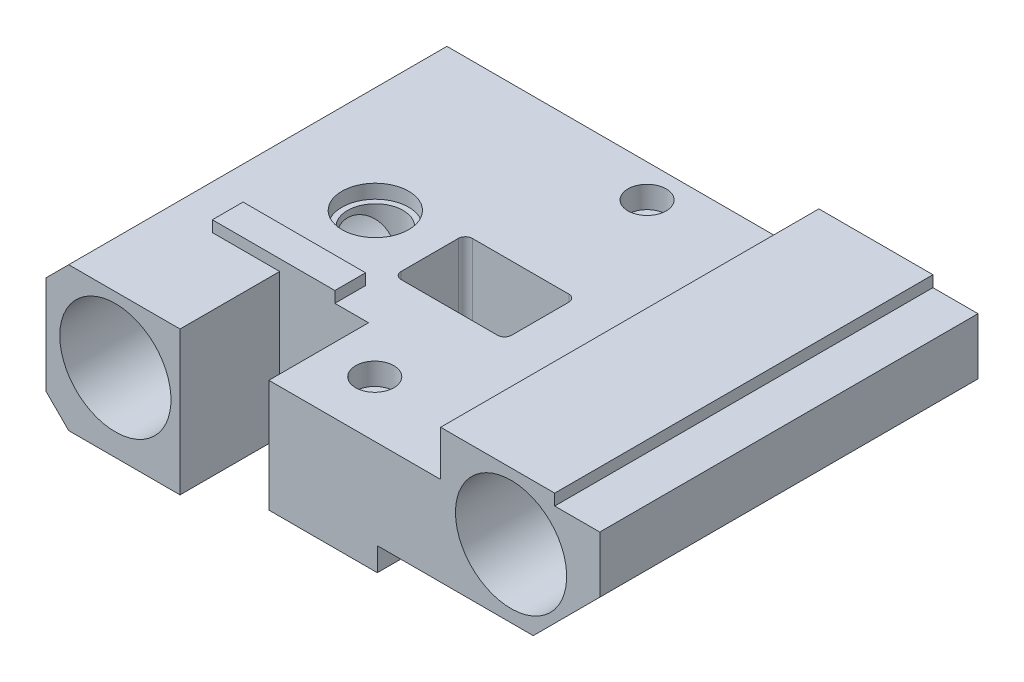
from build123d import *

# Parameters (mm, degrees)
SKETCH1_W           = 158.11
SKETCH1_H           = 108
BOSS_EXTRUDE1_DEPTH = 53.94
SKETCH2_W           = 12.86
SKETCH2_H           = 108
CUT_EXTRUDE1_DEPTH  = 3.2
SKETCH3_W           = 112.68
SKETCH3_H           = 108
CUT_EXTRUDE2_DEPTH  = 12.91
SKETCH4_W           = 104.72
SKETCH4_H           = 108
CUT_EXTRUDE3_DEPTH  = 8.92
SKETCH5_W           = 63.51
SKETCH5_H           = 189.255900931
CUT_EXTRUDE4_DEPTH  = 15.62
SKETCH6_W           = 25.37
SKETCH6_H           = 28.45
CUT_EXTRUDE5_DEPTH  = 199.927865569
SKETCH7_W           = 31.55
SKETCH7_H           = 20.36
CUT_EXTRUDE6_DEPTH  = 196.82194208
FILLET1_R           = 2
CHAMFER1_SIZE       = 6.48
CHAMFER2_SIZE       = 18.99
HOLE1_D             = 31.75
SKETCH10_W          = 19.431
SKETCH10_H          = 43.86
CUT_EXTRUDE7_DEPTH  = 6.223
SKETCH11_R          = 9.525
CUT_EXTRUDE10_DEPTH = 6.6802
SKETCH12_R          = 7.9375
CUT_EXTRUDE11_DEPTH = 198.221349747
CUT_EXTRUDE12_START = -3.9624
SKETCH13_R          = 9.525
CUT_EXTRUDE12_DEPTH = 3.9624
SKETCH14_W          = 34.9758
SKETCH14_H          = 8.763
BOSS_EXTRUDE2_DEPTH = 3.175
HOLE2_D             = 5.7785
HOLE2_CBORE_D       = 10.922
HOLE2_CBORE_DEPTH   = 6.2738
SKETCH18_R          = 7.9375
CUT_EXTRUDE13_DEPTH = 6.35
HOLE3_D             = 5.334
HOLE3_CBORE_D       = 9.0424
HOLE3_CBORE_DEPTH   = 5.334


with BuildPart() as part:
    # Sketch1 → Boss-Extrude1 (new body)
    with BuildSketch(Plane(origin=(0, 0, 0), x_dir=(1, 0, 0), z_dir=(0, 1, 0))):
        with Locations((79.055, -54)):
            Rectangle(SKETCH1_W, SKETCH1_H)
    extrude(amount=BOSS_EXTRUDE1_DEPTH)

    # Sketch2 → Cut-Extrude1 (cut)
    with BuildSketch(Plane(origin=(0, 53.94, 0), x_dir=(-1, 0, 0), z_dir=(0, 1, 0))):
        with Locations((-151.68, 54)):
            Rectangle(SKETCH2_W, SKETCH2_H)
    extrude(amount=-CUT_EXTRUDE1_DEPTH, mode=Mode.SUBTRACT)

    # Sketch3 → Cut-Extrude2 (cut)
    with BuildSketch(Plane(origin=(0, 53.94, 0), x_dir=(-1, 0, 0), z_dir=(0, 1, 0))):
        with Locations((-56.34, 54)):
            Rectangle(SKETCH3_W, SKETCH3_H)
    extrude(amount=-CUT_EXTRUDE2_DEPTH, mode=Mode.SUBTRACT)

    # Sketch4 → Cut-Extrude3 (cut)
    with BuildSketch(Plane.XZ):
        with Locations((105.75, 54)):
            Rectangle(SKETCH4_W, SKETCH4_H)
    extrude(amount=-CUT_EXTRUDE3_DEPTH, mode=Mode.SUBTRACT)

    # Sketch5 → Cut-Extrude4 (cut)
    with BuildSketch(Plane.XZ):
        with Locations((126.355, 87.843662975)):
            Rectangle(SKETCH5_W, SKETCH5_H)
    extrude(amount=-CUT_EXTRUDE4_DEPTH, mode=Mode.SUBTRACT)

    # Sketch6 → Cut-Extrude5 (cut, through all)
    with BuildSketch(Plane(origin=(0, 53.94, 0), x_dir=(-1, 0, 0), z_dir=(0, 1, 0))):
        with Locations((-50.955, 93.775)):
            Rectangle(SKETCH6_W, SKETCH6_H)
    extrude(amount=-CUT_EXTRUDE5_DEPTH, mode=Mode.SUBTRACT)

    # Sketch7 → Cut-Extrude6 (cut, through all)
    with BuildSketch(Plane(origin=(0, 41.03, 0), x_dir=(1, 0, 0), z_dir=(0, 1, 0))):
        with Locations((71.375, -54.04)):
            Rectangle(SKETCH7_W, SKETCH7_H)
    extrude(amount=-CUT_EXTRUDE6_DEPTH, mode=Mode.SUBTRACT)

    # Fillet1
    fillet1_edges = [part.edges().sort_by_distance(p)[0] for p in [
        (55.6, 24.975, 64.22),
        (55.6, 24.975, 43.86),
        (87.15, 24.975, 43.86),
        (87.15, 24.975, 64.22),
    ]]
    fillet(fillet1_edges, radius=FILLET1_R)

    # Chamfer1
    chamfer1_edges = [part.edges().sort_by_distance(p)[0] for p in [
        (0, 41.03, 54),
        (0, 0, 54),
    ]]
    chamfer(chamfer1_edges, length=CHAMFER1_SIZE)

    # Chamfer2
    chamfer2_edges = [part.edges().sort_by_distance(p)[0] for p in [
        (158.11, 15.62, 54),
    ]]
    chamfer(chamfer2_edges, length=CHAMFER2_SIZE)

    # Hole1 (through all)
    with Locations(Plane(origin=(0, 0, 0), x_dir=(-1, 0, 0), z_dir=(0, 0, -1))):
        with Locations((-19.812, 22.225), (-132.7862, 35.017)):
            Hole(HOLE1_D / 2)

    # Sketch10 → Cut-Extrude7 (cut)
    with BuildSketch(Plane.XZ.offset(-8.92)):
        with Locations((73.5195, 21.93)):
            Rectangle(SKETCH10_W, SKETCH10_H)
    extrude(amount=-CUT_EXTRUDE7_DEPTH, mode=Mode.SUBTRACT)

    # Sketch11 → Cut-Extrude10 (cut)
    with BuildSketch(Plane.XZ):
        with Locations(Location((36.83, 50.8, 0), (0, 0, 270))):
            Circle(SKETCH11_R)
    extrude(amount=-CUT_EXTRUDE10_DEPTH, mode=Mode.SUBTRACT)

    # Sketch12 → Cut-Extrude11 (cut, through all)
    with BuildSketch(Plane.XZ.offset(-6.6802)):
        with Locations(Location((36.83, 50.8, 0), (0, 0, 270))):
            Circle(SKETCH12_R)
    extrude(amount=-CUT_EXTRUDE11_DEPTH, mode=Mode.SUBTRACT)

    # Sketch13 → Cut-Extrude12 (cut)
    with BuildSketch(Plane(origin=(0, 41.03, 0), x_dir=(-1, 0, 0), z_dir=(0, 1, 0)).offset(CUT_EXTRUDE12_START)):
        with Locations(Location((-36.83, 50.8, 0), (0, 0, 270))):
            Circle(SKETCH13_R)
    extrude(amount=CUT_EXTRUDE12_DEPTH, mode=Mode.SUBTRACT)

    # Sketch14 → Boss-Extrude2 (add)
    with BuildSketch(Plane(origin=(0, 41.03, 0), x_dir=(1, 0, 0), z_dir=(0, 1, 0))):
        with Locations((36.5379, -75.1685)):
            Rectangle(SKETCH14_W, SKETCH14_H)
    extrude(amount=BOSS_EXTRUDE2_DEPTH)

    # Hole2 (through all)
    with Locations(Plane(origin=(0, 41.03, 0), x_dir=(-1, 0, 0), z_dir=(0, 1, 0))):
        with Locations((-73.025, 9.398), (-77.864, 91.998)):
            CounterBoreHole(HOLE2_D / 2, HOLE2_CBORE_D / 2, HOLE2_CBORE_DEPTH)

    # Sketch18 → Cut-Extrude13 (cut)
    with BuildSketch(Plane.XZ.offset(-8.92)):
        with Locations(Location((77.864, 91.998, 0), (0, 0, 270))):
            Circle(SKETCH18_R)
    extrude(amount=-CUT_EXTRUDE13_DEPTH, mode=Mode.SUBTRACT)

    # Hole3 (through all)
    with Locations(Plane(origin=(0, 41.03, 0), x_dir=(-1, 0, 0), z_dir=(0, 1, 0))):
        with Locations((-107.2084, 44.5262), (-107.2084, 63.5762)):
            CounterBoreHole(HOLE3_D / 2, HOLE3_CBORE_D / 2, HOLE3_CBORE_DEPTH)


solid = part.part
